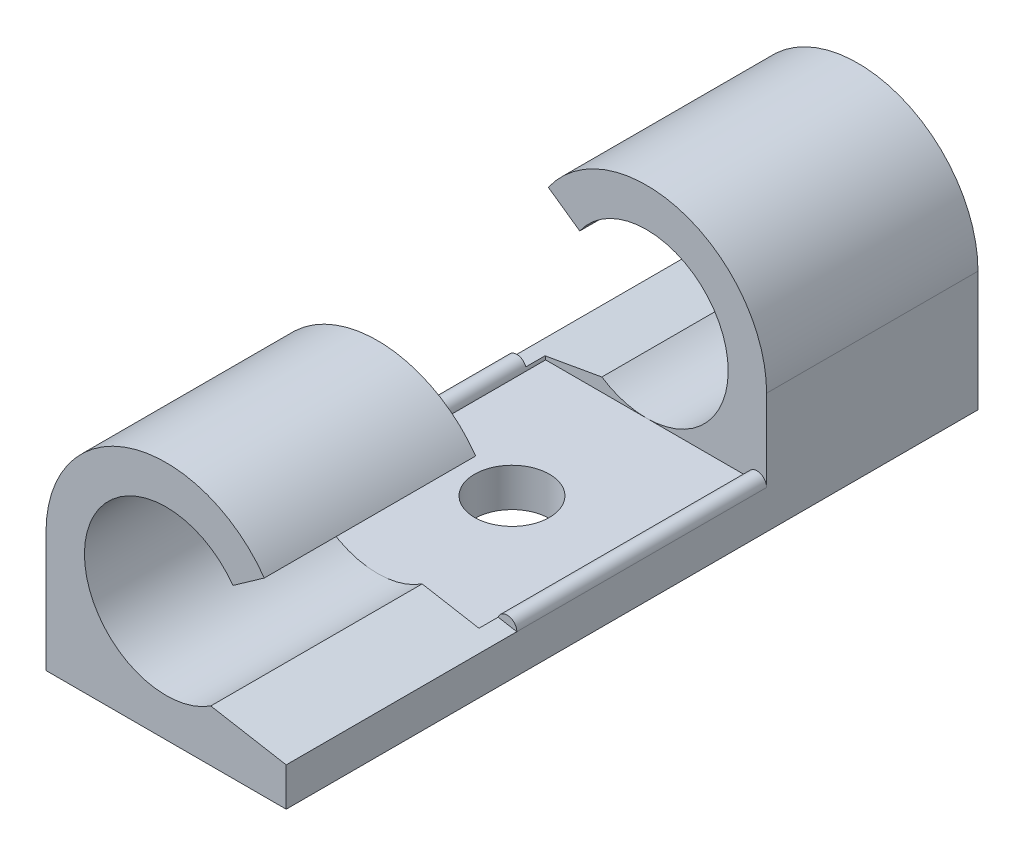
from build123d import *

# Parameters (mm, degrees)
RESSALTO_EXTRUS_O1_DEPTH = 11
ESBO_O2_W                = 12.5
ESBO_O2_H                = 2
RESSALTO_EXTRUS_O2_DEPTH = 7
RESSALTO_EXTRUS_O3_DEPTH = 7
ESBO_O4_R                = 1.95
CORTE_EXTRUS_O1_DEPTH    = 2
CORTE_EXTRUS_O2_DEPTH    = 12
CORTE_EXTRUS_O3_DEPTH    = 12


with BuildPart() as part:
    # Esboço1 → Ressalto-extrusão1 (new body)
    with BuildSketch(Plane.XY):
        with BuildLine():
            Line((-6.25, -6.25), (0, -6.25))
            ThreePointArc((0, -6.25), (-4.419417382, -4.419417382), (-6.25, 0))
            Line((-6.25, 0), (-6.25, -6.25))
        make_face()
        with BuildLine():
            Line((6.25, -6.25), (6.25, 0))
            ThreePointArc((6.25, 0), (4.419417382, -4.419417382), (0, -6.25))
            Line((0, -6.25), (6.25, -6.25))
        make_face()
        with BuildLine():
            ThreePointArc((-4.25, 0), (0, 4.25), (4.25, 0))
            Line((4.25, 0), (6.25, 0))
            ThreePointArc((6.25, 0), (4.419417387, 4.419417378), (1.3e-08, 6.25))
            ThreePointArc((1.3e-08, 6.25), (-4.419417378, 4.419417387), (-6.25, 0))
            Line((-6.25, 0), (-4.25, 0))
        make_face()
        with BuildLine():
            Line((6.25, 0), (4.25, 0))
            ThreePointArc((4.25, 0), (0, -4.25), (-4.25, 0))
            Line((-4.25, 0), (-6.25, 0))
            ThreePointArc((-6.25, 0), (-4.419417382, -4.419417382), (0, -6.25))
            ThreePointArc((0, -6.25), (4.419417382, -4.419417382), (6.25, 0))
        make_face()
    ressalto_extrus_o1 = extrude(amount=RESSALTO_EXTRUS_O1_DEPTH)

    # Esboço2 → Ressalto-extrusão2 (add)
    with BuildSketch(Plane.XY.offset(11)):
        with Locations((0, -5.25)):
            Rectangle(ESBO_O2_W, ESBO_O2_H)
    ressalto_extrus_o2 = extrude(amount=RESSALTO_EXTRUS_O2_DEPTH)

    # Esboço3 → Ressalto-extrusão3 (add)
    with BuildSketch(Plane.XY.offset(18)):
        with BuildLine():
            Line((5.25, -4.25), (6.25, -4.25))
            ThreePointArc((6.25, -4.25), (5.75, -3.75), (5.25, -4.25))
        make_face()
        with BuildLine():
            Line((-6.25, -4.25), (-5.25, -4.25))
            ThreePointArc((-5.25, -4.25), (-5.75, -3.75), (-6.25, -4.25))
        make_face()
    ressalto_extrus_o3 = extrude(amount=-RESSALTO_EXTRUS_O3_DEPTH)

    # Espelhar1: Ressalto-extrusão1, Ressalto-extrusão2, Ressalto-extrusão3 across plane
    add(ressalto_extrus_o1.mirror(Plane(origin=(0, 0, 18), x_dir=(1, 0, 0), z_dir=(0, 0, -1))))
    add(ressalto_extrus_o2.mirror(Plane(origin=(0, 0, 18), x_dir=(1, 0, 0), z_dir=(0, 0, -1))))
    add(ressalto_extrus_o3.mirror(Plane(origin=(0, 0, 18), x_dir=(1, 0, 0), z_dir=(0, 0, -1))))

    # Esboço4 → Corte-extrusão1 (cut)
    with BuildSketch(Plane(origin=(0, -4.25, 0), x_dir=(1, 0, 0), z_dir=(0, 1, 0))):
        with Locations(Location((0, -18, 0), (0, 0, 270))):
            Circle(ESBO_O4_R)
    extrude(amount=-CORTE_EXTRUS_O1_DEPTH, mode=Mode.SUBTRACT)

    # Esboço5 → Corte-extrusão2 (cut)
    with BuildSketch(Plane.XY.offset(36)):
        with BuildLine():
            Line((2.324678961, -3.557859993), (6.25, -4.25))
            Line((6.25, -4.25), (6.25, 0))
            ThreePointArc((6.25, 0), (5.958039408, 1.887926484), (5.109434749, 3.599468925))
            Line((5.109434749, 3.599468925), (3.474415629, 2.447638869))
            ThreePointArc((3.474415629, 2.447638869), (4.051466798, 1.283790009), (4.25, 0))
            ThreePointArc((4.25, 0), (3.737805879, -2.022698002), (2.324678961, -3.557859993))
        make_face()
    extrude(amount=-CORTE_EXTRUS_O2_DEPTH, mode=Mode.SUBTRACT)

    # Esboço6 → Corte-extrusão3 (cut)
    with BuildSketch(Plane(origin=(0, 0, 0), x_dir=(-1, 0, 0), z_dir=(0, 0, -1))):
        with BuildLine():
            Line((2.324678961, -3.557859993), (6.25, -4.25))
            Line((6.25, -4.25), (6.25, 0))
            ThreePointArc((6.25, 0), (5.95810098, 1.887732163), (5.10966953, 3.599135631))
            Line((5.10966953, 3.599135631), (3.474575281, 2.447412229))
            ThreePointArc((3.474575281, 2.447412229), (4.051508666, 1.283657871), (4.25, 0))
            ThreePointArc((4.25, 0), (3.737805879, -2.022698002), (2.324678961, -3.557859993))
        make_face()
    extrude(amount=-CORTE_EXTRUS_O3_DEPTH, mode=Mode.SUBTRACT)


solid = part.part
